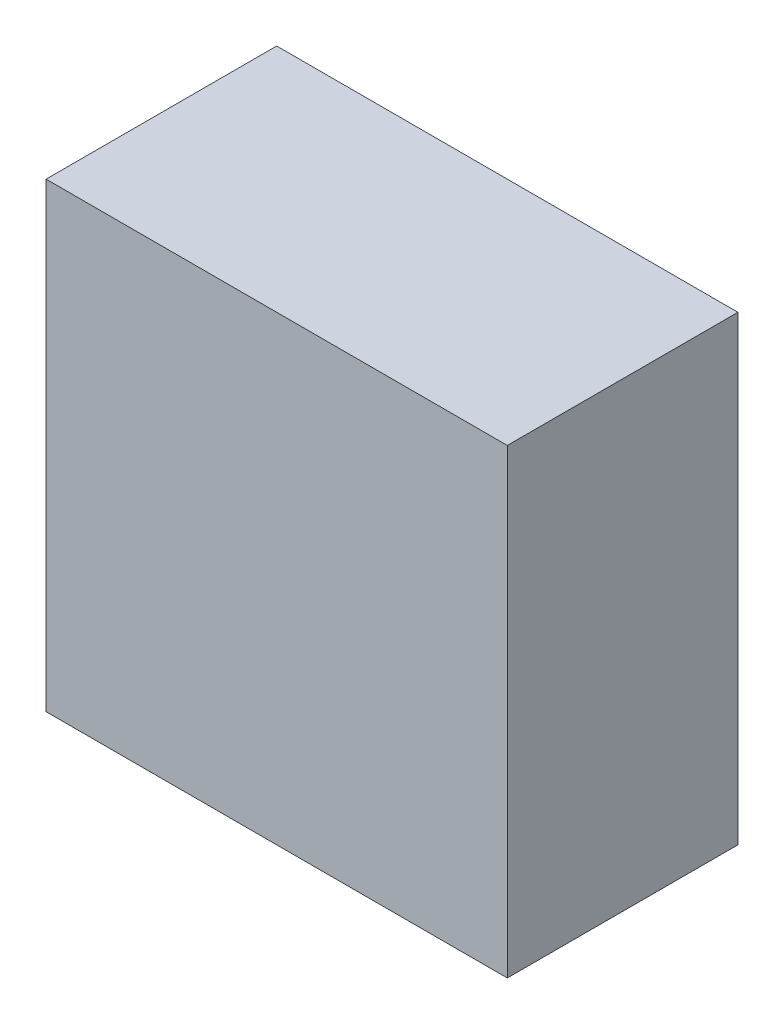
from build123d import *

# Parameters (mm, degrees)
CROQUIS1_W              = 50.8
CROQUIS1_H              = 50.8
SALIENTE_EXTRUIR1_DEPTH = 25.4


with BuildPart() as part:
    # Croquis1 → Saliente-Extruir1 (new body)
    with BuildSketch(Plane.XY):
        Rectangle(CROQUIS1_W, CROQUIS1_H)
    extrude(amount=SALIENTE_EXTRUIR1_DEPTH)


solid = part.part
